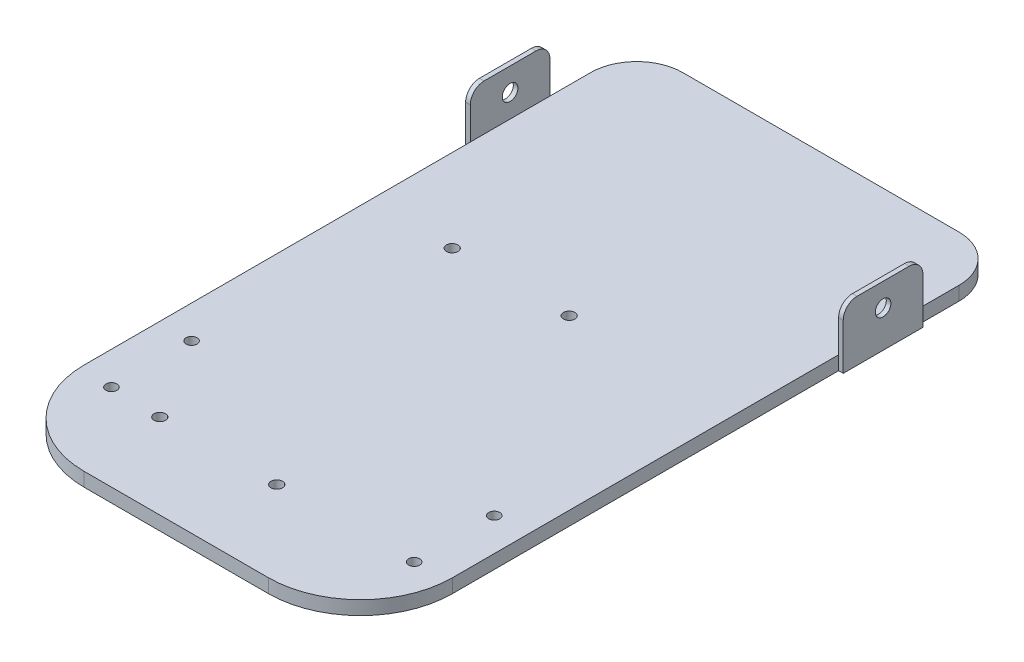
from build123d import *

# Parameters (mm, degrees)
EXTRUDE_1_DEPTH        = 3
FILLET_1_R             = 20
FILLET_2_R             = 20
FILLET_3_R             = 10
SKETCH_2_R             = 1.2
CUT_EXTRUDE_1_DEPTH    = 113.548094016
SKETCH_5_W             = 1
SKETCH_5_H             = 17.3
EXTRUDE_2_DEPTH        = 10
SKETCH_7_R             = 1.7
CUT_EXTRUDE_2_DEPTH    = 133.80840887
FILLET_4_R             = 3
FILLET_4_OF_MIRROR_3_R = 3
HOLE_WIZARD_M3_1_D     = 2.5
HOLE_WIZARD_M3_1_DEPTH = 3
HOLE_WIZARD_M3_1_TIP   = 0.751075774


with BuildPart() as part:
    # 스케치1 → 보스-돌출1 (new body)
    with BuildSketch(Plane(origin=(0, 0, 0), x_dir=(1, 0, 0), z_dir=(0, 1, 0))):
        Polygon((40, -35.228470152), (-40, -35.228470152), (-40, -16.378470152), (-40, 68.621529848), (-41, 68.621529848), (-41, 85.921529848), (-40, 85.921529848), (-40, 104.771529848), (40, 104.771529848), (40, 85.921529848), (41, 85.921529848), (41, 68.621529848), (40, 68.621529848), (40, -16.378470152), align=None)
    extrude(amount=-EXTRUDE_1_DEPTH)

    # 필렛1
    fillet_1_edges = [part.edges().sort_by_distance(p)[0] for p in [
        (-40, -1.5, 35.228470152),
    ]]
    fillet(fillet_1_edges, radius=FILLET_1_R)

    # 필렛2
    fillet_2_edges = [part.edges().sort_by_distance(p)[0] for p in [
        (40, -1.5, 35.228470152),
    ]]
    fillet(fillet_2_edges, radius=FILLET_2_R)

    # 필렛3
    fillet_3_edges = [part.edges().sort_by_distance(p)[0] for p in [
        (-40, -1.5, -104.771529848),
        (40, -1.5, -104.771529848),
    ]]
    fillet(fillet_3_edges, radius=FILLET_3_R)

    # 스케치2 → 컷-돌출1 (cut, through all)
    with BuildSketch(Plane(origin=(0, 0, 0), x_dir=(1, 0, 0), z_dir=(0, 1, 0))):
        with Locations(Location((-32.87, -16.428470152, 0), (0, 0, 270))):
            Circle(SKETCH_2_R)
        with Locations(Location((-32.87, 0.971529848, 0), (0, 0, 90))):
            Circle(SKETCH_2_R)
    cut_extrude_1 = extrude(amount=-CUT_EXTRUDE_1_DEPTH, mode=Mode.SUBTRACT)

    # 대칭 복사1: 컷-돌출1 across plane
    add(cut_extrude_1.mirror(Plane(origin=(0, 0, 0), x_dir=(0, 0, 1), z_dir=(1, 0, 0))), mode=Mode.SUBTRACT)

    # 스케치5 → 보스-돌출2 (add)
    with BuildSketch(Plane(origin=(0, 0, 0), x_dir=(1, 0, 0), z_dir=(0, 1, 0))):
        with Locations((-40.5, 77.271529848)):
            Rectangle(SKETCH_5_W, SKETCH_5_H)
    extrude_2 = extrude(amount=EXTRUDE_2_DEPTH)

    # 스케치7 → 컷-돌출2 (cut, through all)
    with BuildSketch(Plane(origin=(-40, 0, 0), x_dir=(0, 0, -1), z_dir=(1, 0, 0))):
        with Locations((77.271529848, 5)):
            Circle(SKETCH_7_R)
    cut_extrude_2 = extrude(amount=-CUT_EXTRUDE_2_DEPTH, mode=Mode.SUBTRACT)

    # 필렛4
    fillet_4_edges = [part.edges().sort_by_distance(p)[0] for p in [
        (-40.5, 10, -68.621529848),
        (-40.5, 10, -85.921529848),
    ]]
    fillet(fillet_4_edges, radius=FILLET_4_R)

    # 대칭 복사3: 보스-돌출2, 컷-돌출2 across plane
    add(extrude_2.mirror(Plane(origin=(0, 0, 0), x_dir=(0, 0, 1), z_dir=(1, 0, 0))))
    add(cut_extrude_2.mirror(Plane(origin=(0, 0, 0), x_dir=(0, 0, 1), z_dir=(1, 0, 0))), mode=Mode.SUBTRACT)

    # 필렛4 of 대칭 복사3
    fillet_4_of_mirror_3_edges = [part.edges().sort_by_distance(p)[0] for p in [
        (40.5, 10, -68.621529848),
        (40.5, 10, -85.921529848),
    ]]
    fillet(fillet_4_of_mirror_3_edges, radius=FILLET_4_OF_MIRROR_3_R)

    # M3 탭을 위한 탭 드릴1
    with Locations(Plane(origin=(0, 0, 0), x_dir=(1, 0, 0), z_dir=(0, 1, 0))):
        with Locations((-22, -16.800227959), (3.4, -16.800227959), (3.4, 46.699772041), (-22, 46.699772041)):
            Hole(HOLE_WIZARD_M3_1_D / 2, depth=HOLE_WIZARD_M3_1_DEPTH)
            with Locations((0, 0, -(HOLE_WIZARD_M3_1_DEPTH + HOLE_WIZARD_M3_1_TIP / 2))):  # 118° drill point
                Cone(0, HOLE_WIZARD_M3_1_D / 2, HOLE_WIZARD_M3_1_TIP, mode=Mode.SUBTRACT)


solid = part.part
